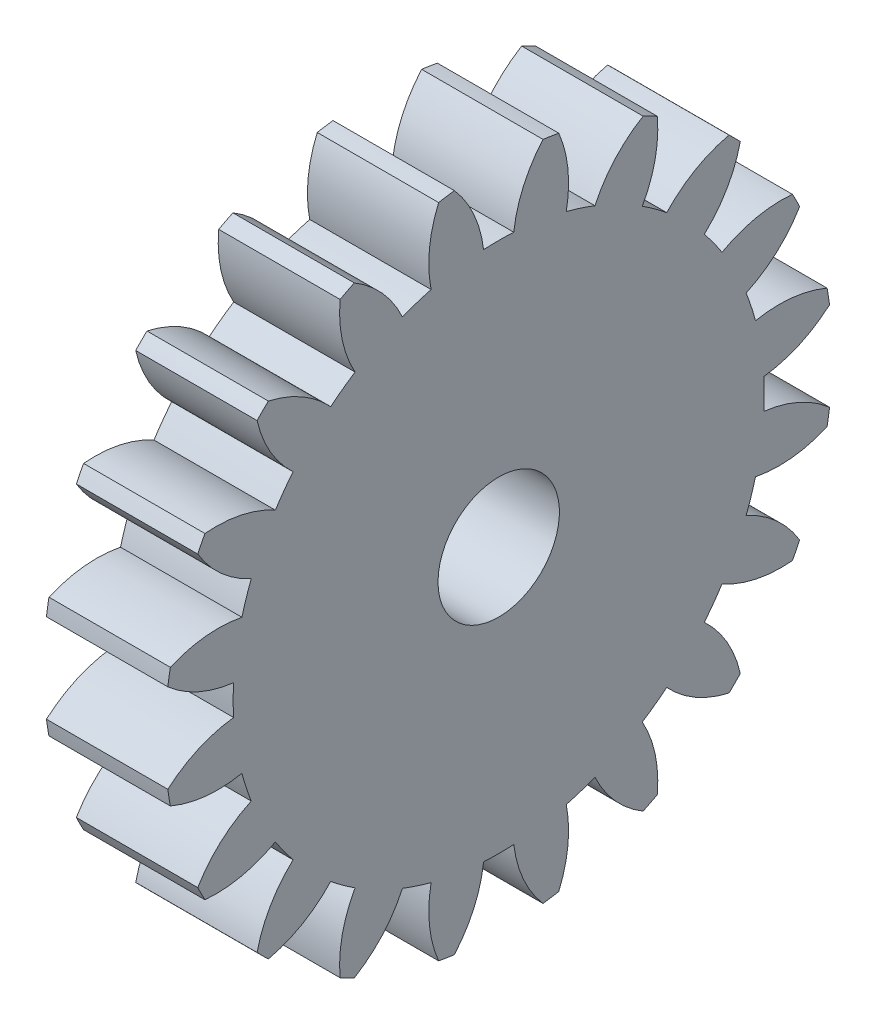
from build123d import *

# Parameters (mm, degrees)
BASPROSKE_W     = 12.7
BASPROSKE_H     = 34.925
TOOTHCUT_DEPTH  = 51.998051433
TEETHCUTS_COUNT = 20
TEETHCUTS_ANGLE = 342
BORSKE_R        = 6.35
BORE_DEPTH      = 50.8000508


with BuildPart() as part:
    # BasProSke → Base-Revolve (revolve)
    with BuildSketch(Plane(origin=(0, 0, 0), x_dir=(1, 0, 0), z_dir=(0, 1, 0)), mode=Mode.PRIVATE) as base_revolve_sk:
        with Locations((6.35, 17.4625)):
            Rectangle(BASPROSKE_W, BASPROSKE_H)
    revolve(base_revolve_sk.sketch.rotate(Axis((-10, 0, 0), (1, 0, 0)), 180), axis=Axis((-10, 0, 0), (1, 0, 0)))

    # TooCutSke → ToothCut (cut, through all)
    with BuildSketch(Plane(origin=(0, 0, 0), x_dir=(0, 0, -1), z_dir=(1, 0, 0))):
        with BuildLine():
            ThreePointArc((1.577750771, 27.735140009), (0, 27.77998), (-1.577750771, 27.735140009))
            ThreePointArc((-1.577750771, 27.735140009), (-2.592920906, 31.421395969), (-4.659230133, 34.638447349))
            ThreePointArc((-4.659230133, 34.638447349), (0, 34.9504), (4.659230133, 34.638447349))
            ThreePointArc((4.659230133, 34.638447349), (2.592920906, 31.421395969), (1.577750771, 27.735140009))
        make_face()
    toothcut = extrude(amount=TOOTHCUT_DEPTH, mode=Mode.SUBTRACT)

    # TeethCuts: ToothCut ×20 about axis
    teethcuts_axis = Axis((-10, 0, 0), (1, 0, 0))
    for i in range(1, TEETHCUTS_COUNT):
        add(toothcut.rotate(teethcuts_axis, i * TEETHCUTS_ANGLE / (TEETHCUTS_COUNT - 1)), mode=Mode.SUBTRACT)

    # BorSke → Bore (cut, symmetric)
    with BuildSketch(Plane(origin=(0, 0, 0), x_dir=(0, 0, -1), z_dir=(1, 0, 0))):
        with Locations(Location((0, 0, 0), (0, 0, 180))):
            Circle(BORSKE_R)
    extrude(amount=BORE_DEPTH, both=True, mode=Mode.SUBTRACT)


solid = part.part
